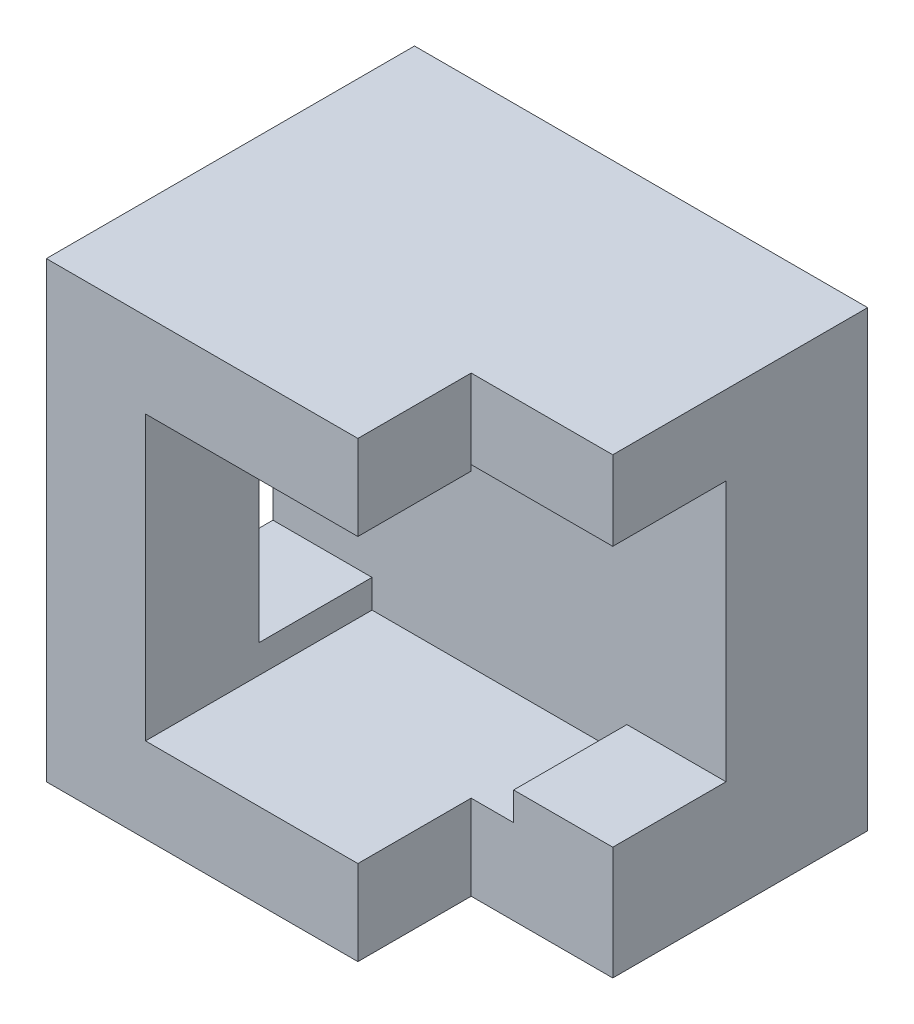
from build123d import *

# Parameters (mm, degrees)
IZIM1_W                     = 80
IZIM1_H                     = 80
Y_KSEKLIK_EKSTR_ZYON1_DEPTH = 65
IZIM3_W                     = 45
IZIM3_H                     = 50
KES_EKSTR_ZYON1_DEPTH       = 40
IZIM4_W                     = 20
IZIM4_H                     = 46
KES_EKSTR_ZYON2_DEPTH       = 80
IZIM5_W                     = 25
IZIM5_H                     = 20
KES_EKSTR_ZYON3_DEPTH       = 111.566721937


with BuildPart() as part:
    # Çizim1 → Yükseklik-Ekstrüzyon1 (new body)
    with BuildSketch(Plane.XY):
        Rectangle(IZIM1_W, IZIM1_H)
    extrude(amount=Y_KSEKLIK_EKSTR_ZYON1_DEPTH)

    # Çizim3 → Kes-Ekstrüzyon1 (cut)
    with BuildSketch(Plane.XY.offset(65)):
        Rectangle(IZIM3_W, IZIM3_H)
    extrude(amount=-KES_EKSTR_ZYON1_DEPTH, mode=Mode.SUBTRACT)

    # Çizim4 → Kes-Ekstrüzyon2 (cut)
    with BuildSketch(Plane(origin=(40, 0, 0), x_dir=(0, 0, -1), z_dir=(1, 0, 0))):
        with Locations((-35, 3)):
            Rectangle(IZIM4_W, IZIM4_H)
    extrude(amount=-KES_EKSTR_ZYON2_DEPTH, mode=Mode.SUBTRACT)

    # Çizim5 → Kes-Ekstrüzyon3 (cut, through all)
    with BuildSketch(Plane.XZ.offset(40)):
        with Locations((27.5, 55)):
            Rectangle(IZIM5_W, IZIM5_H)
    extrude(amount=-KES_EKSTR_ZYON3_DEPTH, mode=Mode.SUBTRACT)


solid = part.part
